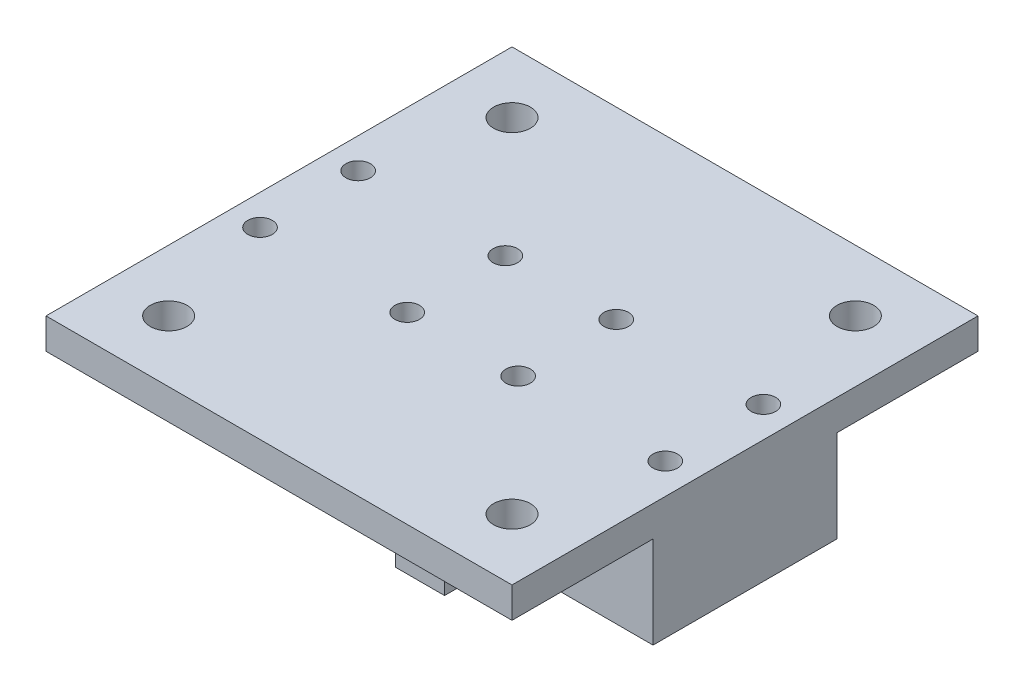
from build123d import *

# Parameters (mm, degrees)
BOSS_EXTRUDE1_DEPTH = 30
SKETCH2_W           = 76
SKETCH2_H           = 5
BOSS_EXTRUDE2_DEPTH = 23
SKETCH3_W           = 76
SKETCH3_H           = 5
BOSS_EXTRUDE3_DEPTH = 23
SKETCH4_W           = 8
SKETCH4_H           = 20
CUT_EXTRUDE1_DEPTH  = 5
SKETCH5_R           = 2
CUT_EXTRUDE2_DEPTH  = 20
SKETCH6_R           = 3
CUT_EXTRUDE3_DEPTH  = 5


with BuildPart() as part:
    # Sketch1 → Boss-Extrude1 (new body)
    with BuildSketch(Plane.XY):
        Polygon((0, 15), (38, 15), (38, 10), (38, -5), (4, -5), (4, -15), (0, -15), (-4, -15), (-4, -5), (-38, -5), (-38, 10), (-38, 15), align=None)
        Polygon((-2.5, -5), (2.5, -5), (2.5, -7.5), (2.5, -10), (0, -10), (-2.5, -10), (-2.5, -7.5), align=None, mode=Mode.SUBTRACT)
    extrude(amount=-BOSS_EXTRUDE1_DEPTH)

    # Sketch2 → Boss-Extrude2 (add)
    with BuildSketch(Plane.XY):
        with Locations((0, 12.5)):
            Rectangle(SKETCH2_W, SKETCH2_H)
    extrude(amount=BOSS_EXTRUDE2_DEPTH)

    # Sketch3 → Boss-Extrude3 (add)
    with BuildSketch(Plane(origin=(0, 0, -30), x_dir=(-1, 0, 0), z_dir=(0, 0, -1))):
        with Locations((0, 12.5)):
            Rectangle(SKETCH3_W, SKETCH3_H)
    extrude(amount=BOSS_EXTRUDE3_DEPTH)

    # Sketch4 → Cut-Extrude1 (cut)
    with BuildSketch(Plane(origin=(0, -15, 0), x_dir=(-1, 0, 0), z_dir=(0, -1, 0))):
        with Locations((0, 15)):
            Rectangle(SKETCH4_W, SKETCH4_H)
    extrude(amount=-CUT_EXTRUDE1_DEPTH, mode=Mode.SUBTRACT)

    # Sketch5 → Cut-Extrude2 (cut)
    with BuildSketch(Plane(origin=(0, -5, 0), x_dir=(-1, 0, 0), z_dir=(0, -1, 0))):
        with Locations(Location((33.048249635, 6.95460219, 0), (0, 0, 90))):
            Circle(SKETCH5_R)
        with Locations(Location((9.048249635, 6.95460219, 0), (0, 0, 90))):
            Circle(SKETCH5_R)
        with Locations(Location((33.048249635, 22.95460219, 0), (0, 0, 90))):
            Circle(SKETCH5_R)
        with Locations(Location((9.048249635, 22.95460219, 0), (0, 0, 90))):
            Circle(SKETCH5_R)
        with Locations(Location((-9, 7, 0), (0, 0, 90))):
            Circle(SKETCH5_R)
        with Locations(Location((-33, 7, 0), (0, 0, 90))):
            Circle(SKETCH5_R)
        with Locations(Location((-33, 23, 0), (0, 0, 90))):
            Circle(SKETCH5_R)
        with Locations(Location((-9, 23, 0), (0, 0, 90))):
            Circle(SKETCH5_R)
    extrude(amount=-CUT_EXTRUDE2_DEPTH, mode=Mode.SUBTRACT)

    # Sketch6 → Cut-Extrude3 (cut)
    with BuildSketch(Plane(origin=(0, 15, 0), x_dir=(1, 0, 0), z_dir=(0, 1, 0))):
        with Locations(Location((28, -13, 0), (0, 0, 270))):
            Circle(SKETCH6_R)
        with Locations(Location((-28, -13, 0), (0, 0, 270))):
            Circle(SKETCH6_R)
        with Locations(Location((-28, 43, 0), (0, 0, 270))):
            Circle(SKETCH6_R)
        with Locations(Location((28, 43, 0), (0, 0, 270))):
            Circle(SKETCH6_R)
    extrude(amount=-CUT_EXTRUDE3_DEPTH, mode=Mode.SUBTRACT)


solid = part.part
